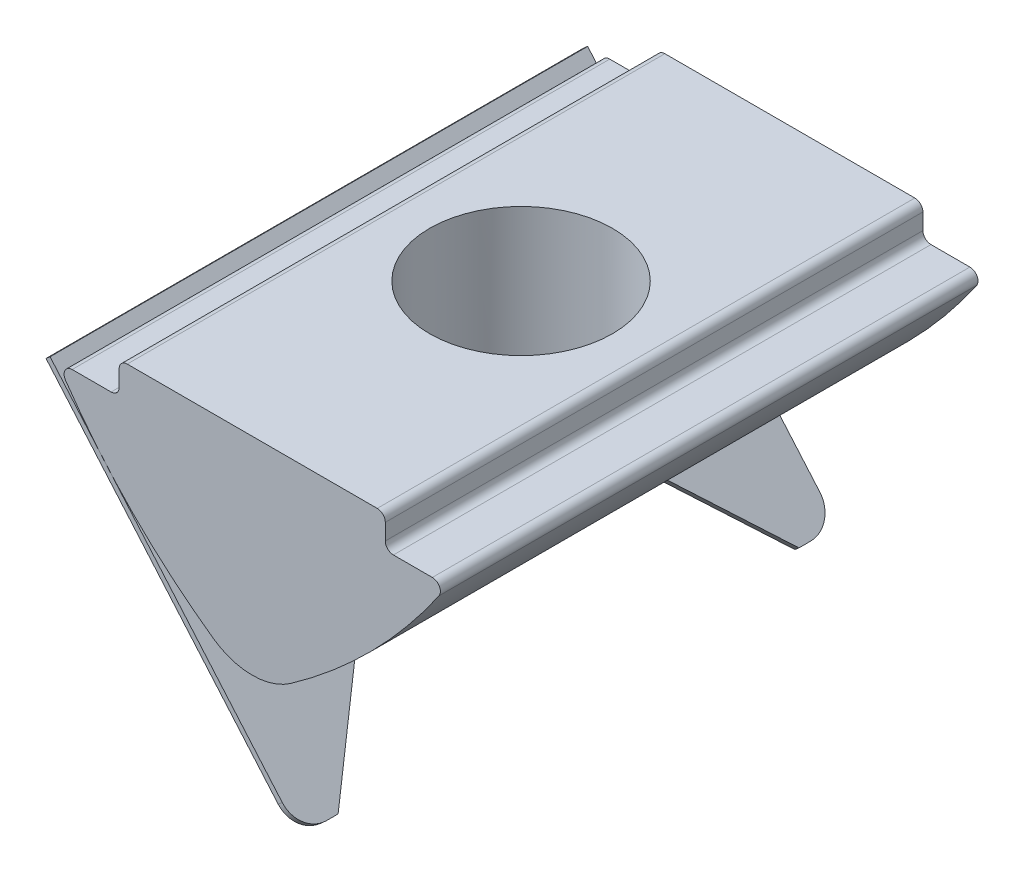
from build123d import *

# Parameters (mm, degrees)
EXTRUDE_1_DEPTH        = 10
HOLE_WIZARD_M8_1_D     = 6.8
HOLE_WIZARD_M8_1_DEPTH = 19.75
HOLE_WIZARD_M8_1_TIP   = 2.042926105
EXTRUDE_2_DEPTH        = 20
CUT_EXTRUDE_1_DEPTH    = 0.2


with BuildPart() as part:
    # 草图1 → 凸台-拉伸1 (new, symmetric)
    with BuildSketch(Plane.XY):
        with BuildLine():
            ThreePointArc((-4.65, 0), (-4.862132034, -0.087867966), (-4.95, -0.3))
            Line((-4.95, -0.3), (-4.95, -0.9))
            ThreePointArc((-4.95, -0.9), (-5.037867966, -1.112132034), (-5.25, -1.2))
            Line((-5.25, -1.2), (-6.7, -1.2))
            ThreePointArc((-6.7, -1.2), (-6.963642143, -1.356846864), (-6.951607997, -1.663381198))
            ThreePointArc((-6.951607997, -1.663381198), (-4.450280622, -4.690515113), (-1.456621363, -7.231810573))
            ThreePointArc((-1.456621363, -7.231810573), (-1.442125297, -7.242125027), (-1.427556197, -7.252336061))
            ThreePointArc((-1.427556197, -7.252336061), (0, -7.7), (1.427556197, -7.252336061))
            ThreePointArc((1.427556197, -7.252336061), (1.442125297, -7.242125027), (1.456621363, -7.231810573))
            ThreePointArc((1.456621363, -7.231810573), (4.450280622, -4.690515113), (6.951607997, -1.663381198))
            ThreePointArc((6.951607997, -1.663381198), (6.963642143, -1.356846864), (6.7, -1.2))
            Line((6.7, -1.2), (5.25, -1.2))
            ThreePointArc((5.25, -1.2), (5.037867966, -1.112132034), (4.95, -0.9))
            Line((4.95, -0.9), (4.95, -0.3))
            ThreePointArc((4.95, -0.3), (4.862132034, -0.087867966), (4.65, 0))
            Line((4.65, 0), (-4.65, 0))
        make_face()
    extrude(amount=EXTRUDE_1_DEPTH, both=True)

    # M8 螺纹孔1
    with Locations(Plane.ZX):
        with Locations((0, 0)):
            Hole(HOLE_WIZARD_M8_1_D / 2, depth=HOLE_WIZARD_M8_1_DEPTH)
            with Locations((0, 0, -(HOLE_WIZARD_M8_1_DEPTH + HOLE_WIZARD_M8_1_TIP / 2))):  # 118° drill point
                Cone(0, HOLE_WIZARD_M8_1_D / 2, HOLE_WIZARD_M8_1_TIP, mode=Mode.SUBTRACT)


with BuildPart() as body_2:
    # 草图5 → 凸台-拉伸2 (new body)
    with BuildSketch(Plane.XY.offset(10)):
        Polygon((-7.52115968, -1.2), (1.767296875, -12), (1.615663005, -12.130411539), (-7.67279355, -1.330411539), align=None)
    extrude(amount=-EXTRUDE_2_DEPTH)

    # 草图6 → 切除-拉伸1 (cut)
    with BuildSketch(Plane(origin=(-5.068196823, -4.358863519, 0), x_dir=(0, 0, 1), z_dir=(-0.7581693513781735, -0.6520576927165261, 0))):
        with BuildLine():
            Line((-1.567384684, -3.013509016), (1.567384684, -3.013509016))
            ThreePointArc((1.567384684, -3.013509016), (2.412621207, -3.200893441), (3.09947357, -3.727933796))
            Line((3.09947357, -3.727933796), (8.572482406, -10.250411739))
            Line((8.572482406, -10.250411739), (9, -10.250411739))
            ThreePointArc((9, -10.250411739), (9.707106781, -9.95751852), (10, -9.250411739))
            Line((10, -9.250411739), (10, -6.702977697))
            Line((10, -6.702977697), (14.457590001, -13.418778721))
            Line((14.457590001, -13.418778721), (-1.066661314, -21.025239845))
            Line((-1.066661314, -21.025239845), (-16.310353871, -17.222009283))
            Line((-16.310353871, -17.222009283), (-10, -6.702977697))
            Line((-10, -6.702977697), (-10, -9.250411739))
            ThreePointArc((-10, -9.250411739), (-9.707106781, -9.95751852), (-9, -10.250411739))
            Line((-9, -10.250411739), (-8.572482406, -10.250411739))
            Line((-8.572482406, -10.250411739), (-3.09947357, -3.727933796))
            ThreePointArc((-3.09947357, -3.727933796), (-2.412621207, -3.200893441), (-1.567384684, -3.013509016))
        make_face()
    extrude(amount=-CUT_EXTRUDE_1_DEPTH, mode=Mode.SUBTRACT)


solid = Compound([part.part, body_2.part])
